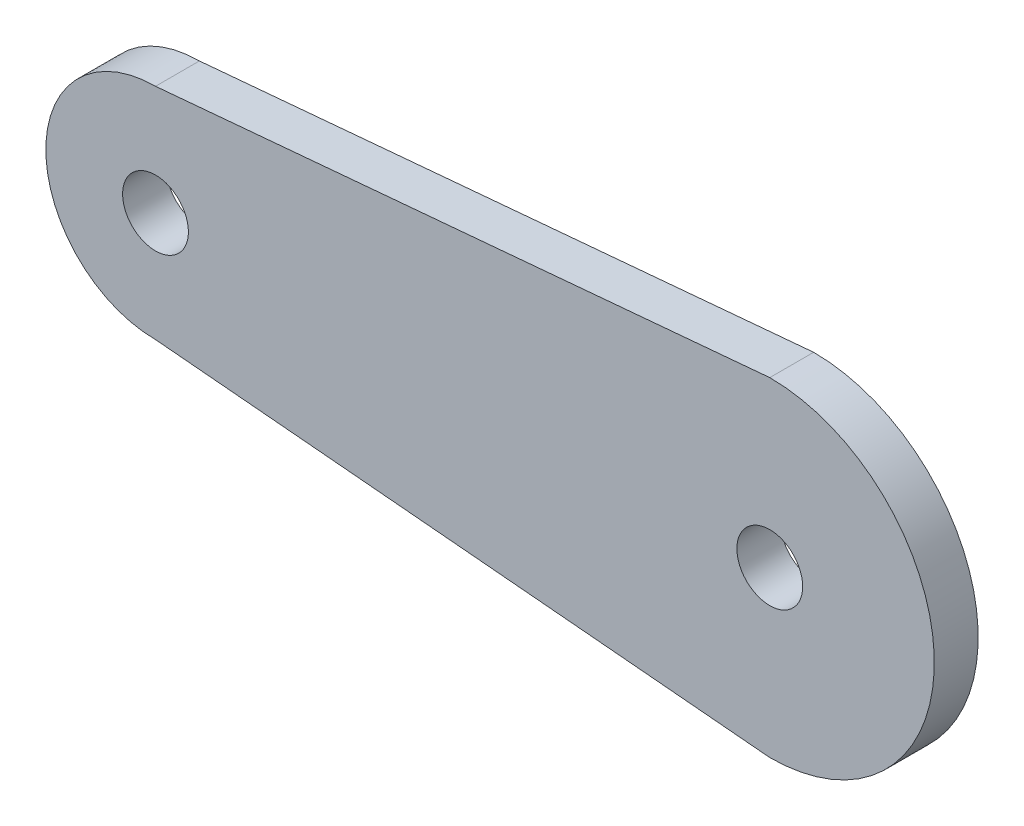
from build123d import *

# Parameters (mm, degrees)
SKETCH1_R           = 1.5
BOSS_EXTRUDE1_DEPTH = 16
SKETCH3_W           = 48.560524615
SKETCH3_H           = 12
CUT_EXTRUDE1_DEPTH  = 42.728287767
SKETCH4_W           = 43.208951525
SKETCH4_H           = 16.914851134
CUT_EXTRUDE2_DEPTH  = 10


with BuildPart() as part:
    # Sketch1 → Boss-Extrude1 (new body)
    with BuildSketch(Plane.XY):
        with BuildLine():
            ThreePointArc((28, 7.5), (35.5, 0), (28, -7.5))
            Line((28, -7.5), (0, -5))
            ThreePointArc((0, -5), (-5, 0), (0, 5))
            Line((0, 5), (28, 7.5))
        make_face()
        with Locations((28, 0)):
            Circle(SKETCH1_R, mode=Mode.SUBTRACT)
        Circle(SKETCH1_R, mode=Mode.SUBTRACT)
    extrude(amount=BOSS_EXTRUDE1_DEPTH)

    # Sketch3 → Cut-Extrude1 (cut, through all)
    with BuildSketch(Plane(origin=(0, 7.5, 0), x_dir=(1, 0, 0), z_dir=(0, 1, 0))):
        with Locations((17.305581285, -8)):
            Rectangle(SKETCH3_W, SKETCH3_H)
    extrude(amount=-CUT_EXTRUDE1_DEPTH, mode=Mode.SUBTRACT)


with BuildPart() as cut_extrude1_piece_1:
    # of the separate pieces the step leaves, piece 1, a body of its own (cut_extrude1_pieces)
    add(part.part.solids().sort_by_distance((28, 7.5, 0))[0])

    # Sketch4 → Cut-Extrude2 (cut)
    with BuildSketch(Plane(origin=(0, 0, 0), x_dir=(-1, 0, 0), z_dir=(0, 0, -1))):
        with Locations((-14.735208298, -0.104891316)):
            Rectangle(SKETCH4_W, SKETCH4_H)
    extrude(amount=-CUT_EXTRUDE2_DEPTH, mode=Mode.SUBTRACT)


with BuildPart() as cut_extrude1_piece_2:
    # of the separate pieces the step leaves, piece 2, a body of its own (cut_extrude1_pieces)
    add(part.part.solids().sort_by_distance((28, 7.5, 14))[0])


solid = cut_extrude1_piece_2.part
